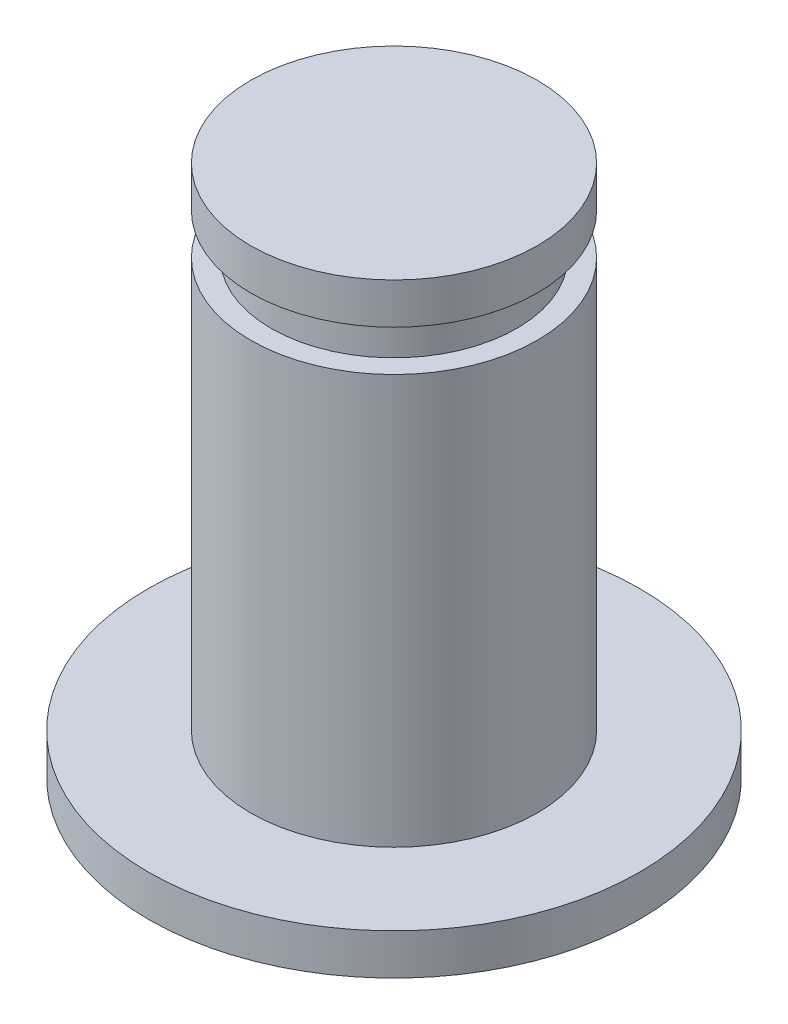
from build123d import *

# Parameters (mm, degrees)
ESBO_O1_R                = 6
RESSALTO_EXTRUS_O1_DEPTH = 1
ESBO_O2_R                = 3.5
RESSALTO_EXTRUS_O2_DEPTH = 12
CORTE_EXTRUS_O1_START    = -2
ESBO_O3_R                = 3.5
ESBO_O3_R_2              = 3
CORTE_EXTRUS_O1_DEPTH    = 1


with BuildPart() as part:
    # Esboço1 → Ressalto-extrusão1 (new body)
    with BuildSketch(Plane(origin=(0, 0, 0), x_dir=(1, 0, 0), z_dir=(0, 1, 0))):
        with Locations(Location((0, 0, 0), (0, 0, 270))):
            Circle(ESBO_O1_R)
    extrude(amount=RESSALTO_EXTRUS_O1_DEPTH)

    # Esboço2 → Ressalto-extrusão2 (add)
    with BuildSketch(Plane(origin=(0, 1, 0), x_dir=(1, 0, 0), z_dir=(0, 1, 0))):
        with Locations(Location((0, 0, 0), (0, 0, 270))):
            Circle(ESBO_O2_R)
    extrude(amount=RESSALTO_EXTRUS_O2_DEPTH)

    # Esboço3 → Corte-extrusão1 (cut)
    with BuildSketch(Plane(origin=(0, 13, 0), x_dir=(1, 0, 0), z_dir=(0, 1, 0)).offset(CORTE_EXTRUS_O1_START)):
        with Locations(Location((0, 0, 0), (0, 0, 270))):
            Circle(ESBO_O3_R)
        with Locations(Location((0, 0, 0), (0, 0, 270))):
            Circle(ESBO_O3_R_2, mode=Mode.SUBTRACT)
    extrude(amount=CORTE_EXTRUS_O1_DEPTH, mode=Mode.SUBTRACT)


solid = part.part
